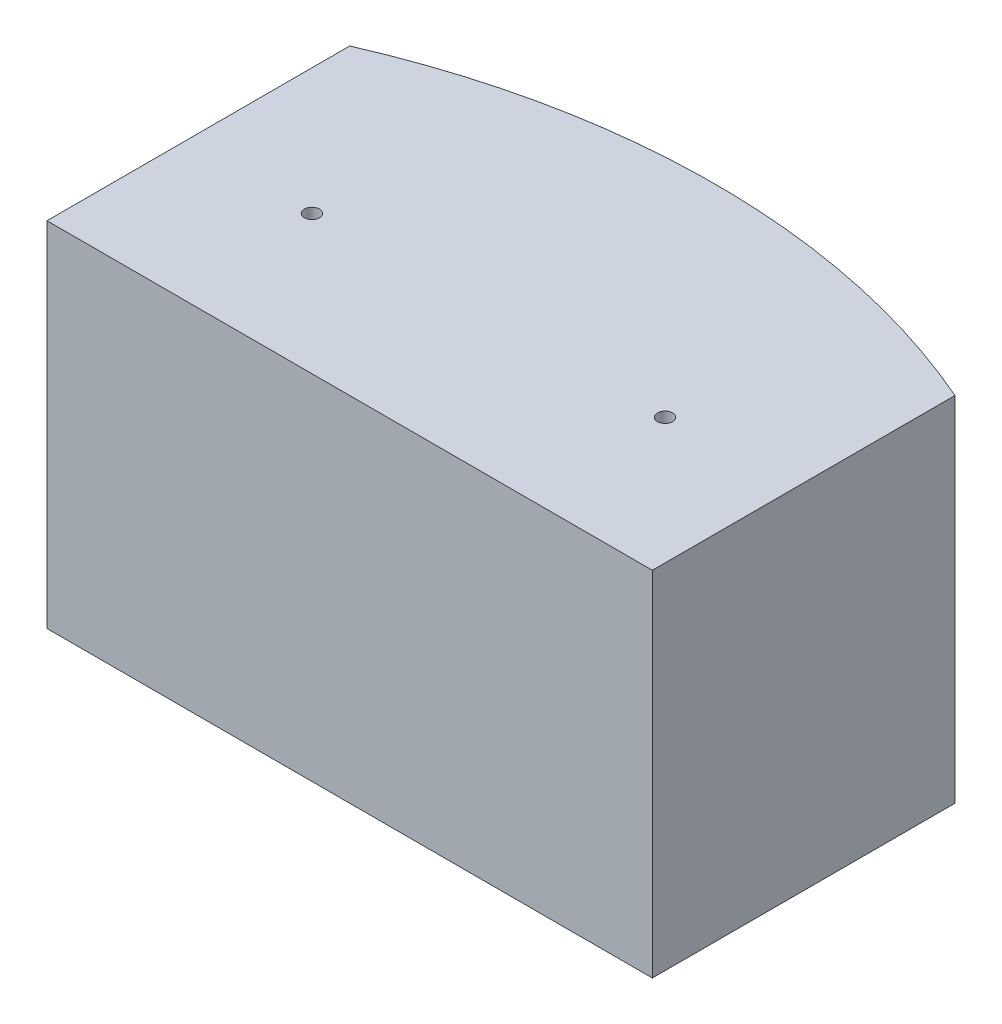
from build123d import *

# Parameters (mm, degrees)
BOSS_EXTRUDE1_DEPTH      = 70
SKETCH7_W                = 114
SKETCH7_H                = 64
CUT_EXTRUDE2_DEPTH       = 77
SKETCH8_W                = 3
SKETCH8_H                = 64
BOSS_EXTRUDE3_DEPTH      = 114
BOSS_EXTRUDE4_REACH      = 117.47
BOSS_EXTRUDE4_END_RADIUS = 150
SKETCH9_W                = 114
SKETCH9_H                = 3
SKETCH10_R               = 1.5
CUT_EXTRUDE3_DEPTH       = 3


with BuildPart() as part:
    # Sketch1 → Boss-Extrude1 (new body)
    with BuildSketch(Plane(origin=(0, 0, 0), x_dir=(1, 0, 0), z_dir=(0, 1, 0))):
        with BuildLine():
            Line((-60, 137.477270849), (-60, 77.477270849))
            Line((-60, 77.477270849), (60, 77.477270849))
            Line((60, 77.477270849), (60, 137.477270849))
            ThreePointArc((60, 137.477270849), (0, 150), (-60, 137.477270849))
        make_face()
    extrude(amount=BOSS_EXTRUDE1_DEPTH)

    # Sketch7 → Cut-Extrude2 (cut)
    with BuildSketch(Plane.XY.offset(-77.477270849)):
        with Locations((0, 35)):
            Rectangle(SKETCH7_W, SKETCH7_H)
    extrude(amount=-CUT_EXTRUDE2_DEPTH, mode=Mode.SUBTRACT)

    # Sketch8 → Boss-Extrude3 (add)
    with BuildSketch(Plane(origin=(-57, 0, 0), x_dir=(0, 0, -1), z_dir=(1, 0, 0))):
        with Locations((78.977270849, 35)):
            Rectangle(SKETCH8_W, SKETCH8_H)
    extrude(amount=BOSS_EXTRUDE3_DEPTH)

    # Boss-Extrude4: up to this cylinder (the profile starts inside it)
    boss_extrude4_end = Plane(origin=(0, 35, 0), z_dir=(0, -1, 0)) * Cylinder(BOSS_EXTRUDE4_END_RADIUS, 535.94, mode=Mode.PRIVATE)
    # Sketch9 → Boss-Extrude4 (add, up to the surface)
    with BuildSketch(Plane(origin=(0, 0, -80.477270849), x_dir=(-1, 0, 0), z_dir=(0, 0, -1)), mode=Mode.PRIVATE) as boss_extrude4_sk1:
        with Locations((0, 35)):
            Rectangle(SKETCH9_W, SKETCH9_H)
    boss_extrude4_tool1 = extrude(boss_extrude4_sk1.sketch, amount=BOSS_EXTRUDE4_REACH, mode=Mode.PRIVATE) & boss_extrude4_end
    add(boss_extrude4_tool1.solids().sort_by_distance((0, 35, -80.477271))[0])

    # Sketch10 → Cut-Extrude3 (cut)
    with BuildSketch(Plane(origin=(0, 70, 0), x_dir=(1, 0, 0), z_dir=(0, 1, 0))):
        with Locations(Location((-35, 104.997270849, 0), (0, 0, 270))):
            Circle(SKETCH10_R)
        with Locations(Location((35, 104.997270849, 0), (0, 0, 270))):
            Circle(SKETCH10_R)
    extrude(amount=-CUT_EXTRUDE3_DEPTH, mode=Mode.SUBTRACT)


solid = part.part
